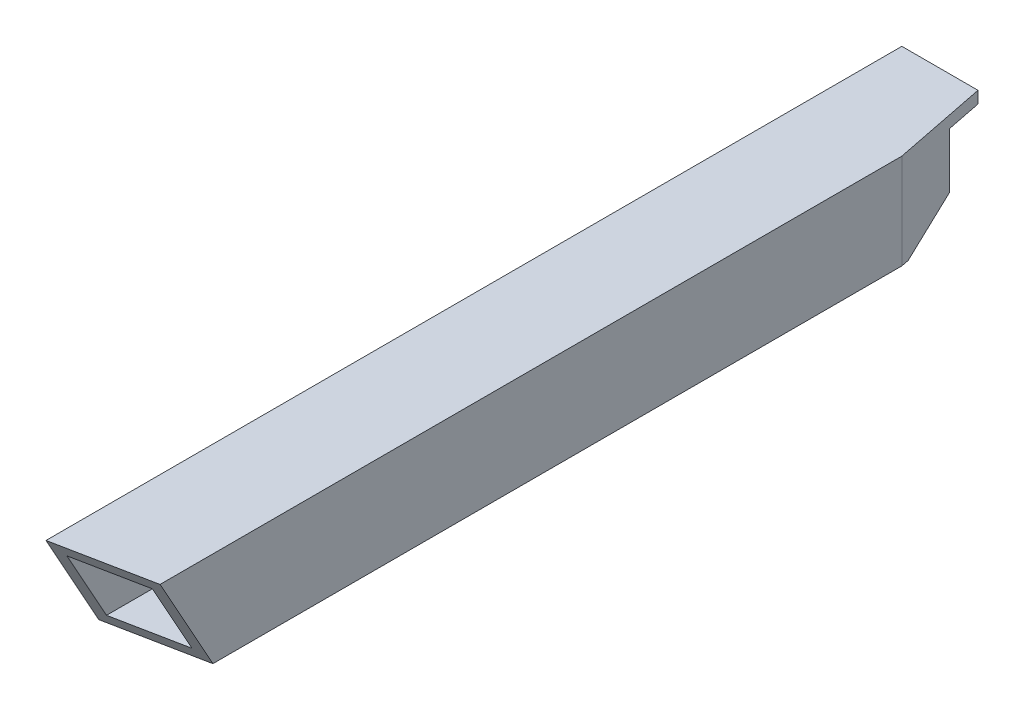
from build123d import *

# Parameters (mm, degrees)
BOSS_EXTRUDE1_DEPTH      = 114.3
BOSS_EXTRUDE1_DEPTH_BACK = 114.3
SKETCH3_W                = 25.4
SKETCH3_H                = 25.4
SKETCH3_W_2              = 19.05
SKETCH3_H_2              = 19.05


with BuildPart() as part:
    # Sketch3 → Boss-Extrude1 (new, two sides: drawn at the far end of the back side and taken through both)
    with BuildSketch(Plane.XY.offset(-BOSS_EXTRUDE1_DEPTH_BACK)):
        Rectangle(SKETCH3_W, SKETCH3_H)
        Rectangle(SKETCH3_W_2, SKETCH3_H_2, mode=Mode.SUBTRACT)
    extrude(amount=BOSS_EXTRUDE1_DEPTH + BOSS_EXTRUDE1_DEPTH_BACK)

    # SurfaceCut2
    split(bisect_by=Plane(origin=(15.454201301, -43.169818655, 77.622710273), x_dir=(0.9807512157806098, 0, -0.1952614983678451), z_dir=(0.17141995510435715, -0.47884508758591265, 0.8610009181684186)), keep=Keep.BOTTOM)

    # SurfaceCut4
    split(bisect_by=Plane(origin=(29.240398856, 0, -5.821582478), x_dir=(0, 1, 0), z_dir=(0.9807512157806096, 0, -0.19526149836784543)), keep=Keep.BOTTOM)

    # SurfaceCut6
    split(bisect_by=Plane(origin=(0.927127028, -48.207550317, -26.27817561), x_dir=(0.9998151166046026, 0.01922843230544169, 0), z_dir=(0.01688375098917382, -0.8778994145657232, -0.478547340247228)), keep=Keep.BOTTOM)


solid = part.part
